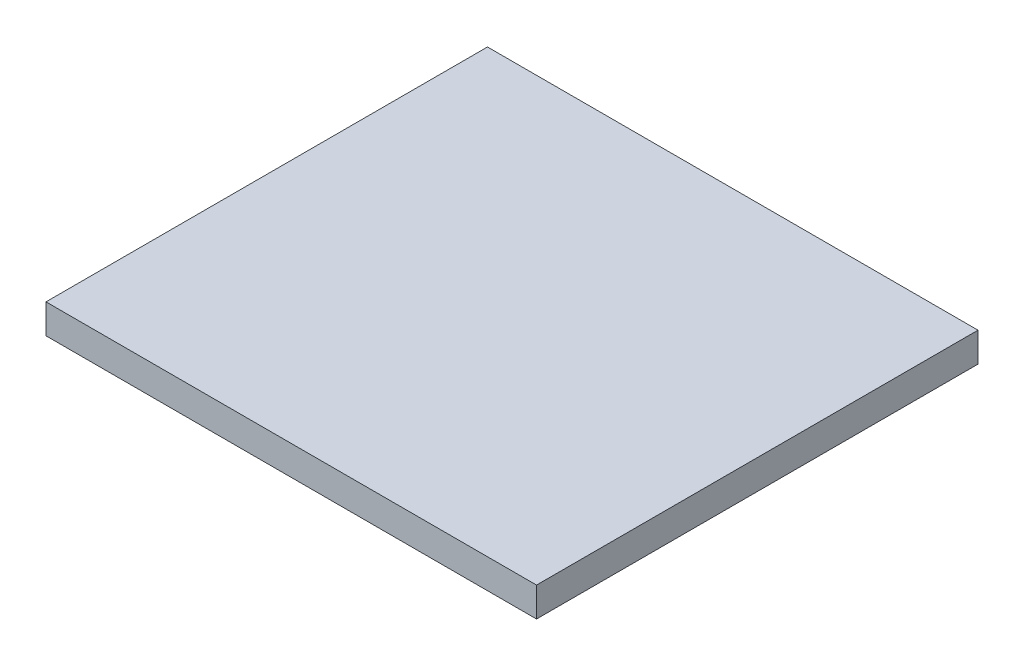
from build123d import *

# Parameters (mm, degrees)
CROQUIS1_W              = 5000
CROQUIS1_H              = 4500
SALIENTE_EXTRUIR1_DEPTH = 300


with BuildPart() as part:
    # Croquis1 → Saliente-Extruir1 (new body)
    with BuildSketch(Plane(origin=(0, 0, 0), x_dir=(1, 0, 0), z_dir=(0, 1, 0))):
        with Locations((2500, 2250)):
            Rectangle(CROQUIS1_W, CROQUIS1_H)
    extrude(amount=SALIENTE_EXTRUIR1_DEPTH)


solid = part.part
